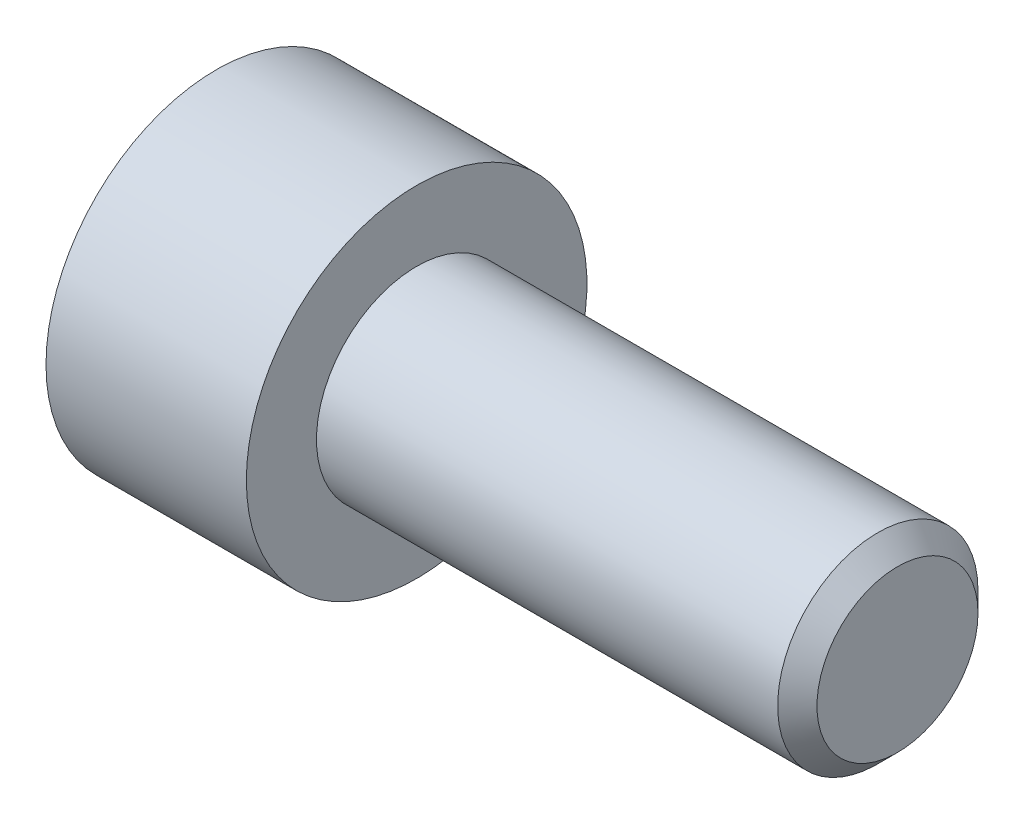
from build123d import *

# Parameters (mm, degrees)
SKETCH1_W           = 5
SKETCH1_H           = 4.25
SKETCH2_R           = 2.5
BOSS_EXTRUDE1_DEPTH = 12
CUT_EXTRUDE1_DEPTH  = 2.5
CHAMFER1_SIZE       = 0.4905


with BuildPart() as part:
    # Sketch1 → Revolve1 (revolve)
    with BuildSketch(Plane(origin=(0, 0, 0), x_dir=(-1, 0, 0), z_dir=(0, 0, -1)), mode=Mode.PRIVATE) as revolve1_sk:
        with Locations((2.5, 2.125)):
            Rectangle(SKETCH1_W, SKETCH1_H)
    revolve(revolve1_sk.sketch.rotate(Axis((0, 0, 0), (-1, 0, 0)), 270), axis=Axis((0, 0, 0), (-1, 0, 0)))

    # Sketch2 → Boss-Extrude1 (add)
    with BuildSketch(Plane(origin=(0, 0, 0), x_dir=(0, 0, -1), z_dir=(1, 0, 0))):
        Circle(SKETCH2_R)
    extrude(amount=BOSS_EXTRUDE1_DEPTH)

    # Sketch3 → Cut-Extrude1 (cut)
    with BuildSketch(Plane.ZY.offset(5)):
        Polygon((2, 1.154700538), (0, 2.309401077), (-2, 1.154700538), (-2, -1.154700538), (0, -2.309401077), (2, -1.154700538), align=None)
    extrude(amount=-CUT_EXTRUDE1_DEPTH, mode=Mode.SUBTRACT)

    # Sketch4 → Cut-Revolve1 (revolve, cut)
    with BuildSketch(Plane.XY, mode=Mode.PRIVATE) as cut_revolve1_sk:
        Polygon((-2.5, 1.99), (-2.5, 0), (-1.351072964, 0), align=None)
    revolve(cut_revolve1_sk.sketch.rotate(Axis((-2.500025, 0, 0), (1, 0, 0)), 90), axis=Axis((-2.500025, 0, 0), (1, 0, 0)), mode=Mode.SUBTRACT)

    # Chamfer1
    chamfer1_edges = [part.edges().sort_by_distance(p)[0] for p in [
        (12, 0, 2.5),
    ]]
    chamfer(chamfer1_edges, length=CHAMFER1_SIZE)


solid = part.part
